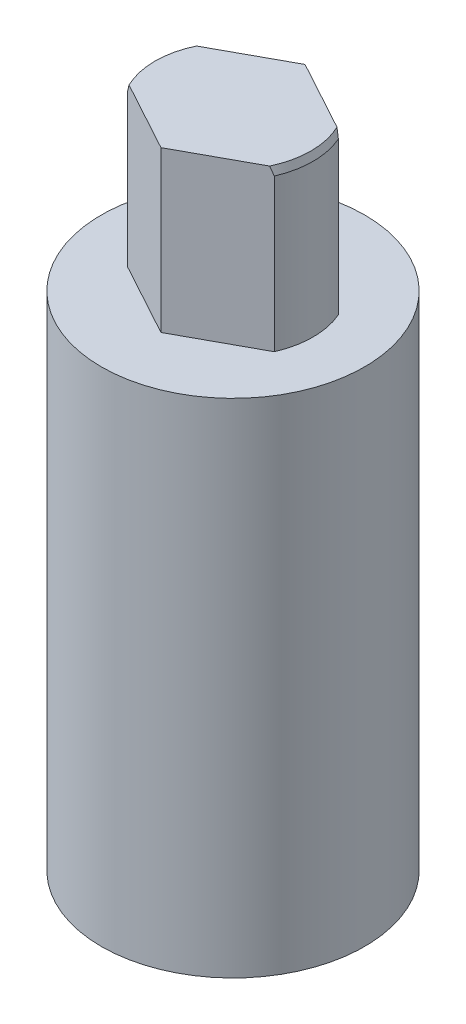
from build123d import *

# Parameters (mm, degrees)
SKETCH_1_R          = 10.0871205
EXTRUDE_1_DEPTH     = 20.174241
SKETCH_2_R          = 16.5871205
EXTRUDE_2_DEPTH     = 63.26
CHAMFER_1_SIZE      = 1
CHAMFER_1_SIZE2     = 0.267949192
SKETCH_4_OUTSIDE_W  = 54.318
SKETCH_4_OUTSIDE_H  = 54.318
CUT_EXTRUDE_2_DEPTH = 20.174241


with BuildPart() as part:
    # Эскиз1 → Бобышка-Вытянуть1 (new body)
    with BuildSketch(Plane(origin=(0, 0, 0), x_dir=(1, 0, 0), z_dir=(0, 1, 0))):
        Circle(SKETCH_1_R)
    extrude(amount=EXTRUDE_1_DEPTH)

    # Эскиз2 → Бобышка-Вытянуть2 (add)
    with BuildSketch(Plane.XZ):
        Circle(SKETCH_2_R)
    extrude(amount=EXTRUDE_2_DEPTH)

    # Фаска1
    chamfer_1_edges = [part.edges().sort_by_distance(p)[0] for p in [
        (-10.0871205, 20.174241, 0),
    ]]
    chamfer_1_side = [part.faces().sort_by_distance(p)[0] for p in [
        (-10.0871205, 10.0871205, 0),
    ]]
    chamfer(chamfer_1_edges, length=CHAMFER_1_SIZE, length2=CHAMFER_1_SIZE2, reference=chamfer_1_side[0])

    # Эскиз4 outside → Вырез-Вытянуть2 (cut)
    with BuildSketch(Plane(origin=(0, 20.174241, 0), x_dir=(1, 0, 0), z_dir=(0, 1, 0))):
        Rectangle(SKETCH_4_OUTSIDE_W, SKETCH_4_OUTSIDE_H)
        with BuildLine():
            Line((-9.244998647, 4.0348482), (0, 9.07840845))
            Line((0, 9.07840845), (9.244998647, 4.0348482))
            ThreePointArc((9.244998647, 4.0348482), (10.0871205, 0), (9.244998647, -4.0348482))
            Line((9.244998647, -4.0348482), (0, -9.07840845))
            Line((0, -9.07840845), (-9.244998647, -4.0348482))
            ThreePointArc((-9.244998647, -4.0348482), (-10.0871205, 0), (-9.244998647, 4.0348482))
        make_face(mode=Mode.SUBTRACT)
    extrude(amount=-CUT_EXTRUDE_2_DEPTH, mode=Mode.SUBTRACT)


solid = part.part
